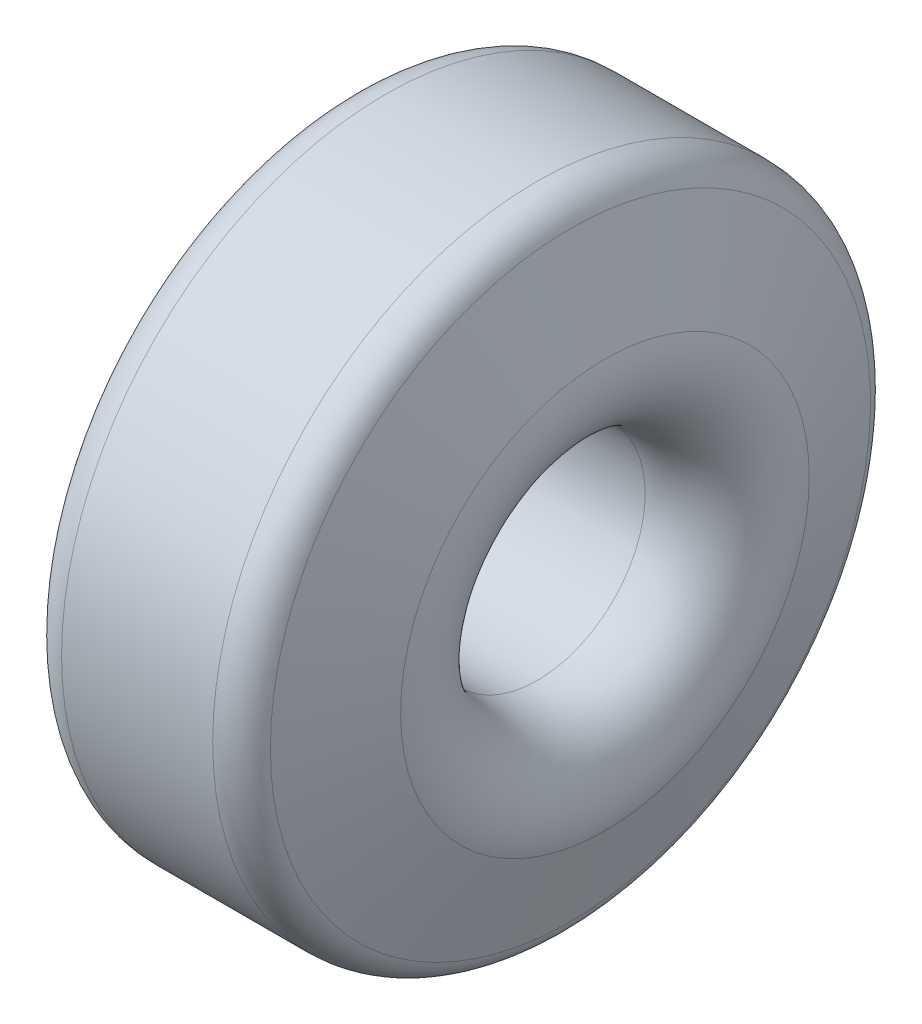
from build123d import *

# Parameters (mm, degrees)
SKETCH_1_W = 4.5
SKETCH_1_H = 3


with BuildPart() as part:
    # Эскиз1 → Повернуть1 (revolve)
    with BuildSketch(Plane.XY, mode=Mode.PRIVATE) as revolve_1_sk:
        with BuildLine():
            Line((2.59417268, 8.339144345), (3.553438332, 5.67828869))
            ThreePointArc((3.553438332, 5.67828869), (3.308517433, 3.85034296), (1.671969637, 3))
            Line((1.671969637, 3), (-2.565092972, 3))
            ThreePointArc((-2.565092972, 3), (-4.201640768, 3.85034296), (-4.446561668, 5.67828869))
            Line((-4.446561668, 5.67828869), (-3.487296015, 8.339144345))
            ThreePointArc((-3.487296015, 8.339144345), (-3.121390188, 8.818273898), (-2.546561668, 9))
            Line((-2.546561668, 9), (1.653438332, 9))
            ThreePointArc((1.653438332, 9), (2.228266853, 8.818273898), (2.59417268, 8.339144345))
        make_face()
        with Locations((-0.446561668, 6.5)):
            Rectangle(SKETCH_1_W, SKETCH_1_H, mode=Mode.SUBTRACT)
    revolve(revolve_1_sk.sketch.rotate(Axis((-29.711247444, 0, 0), (1, 0, 0)), 90), axis=Axis((-29.711247444, 0, 0), (1, 0, 0)))


solid = part.part
